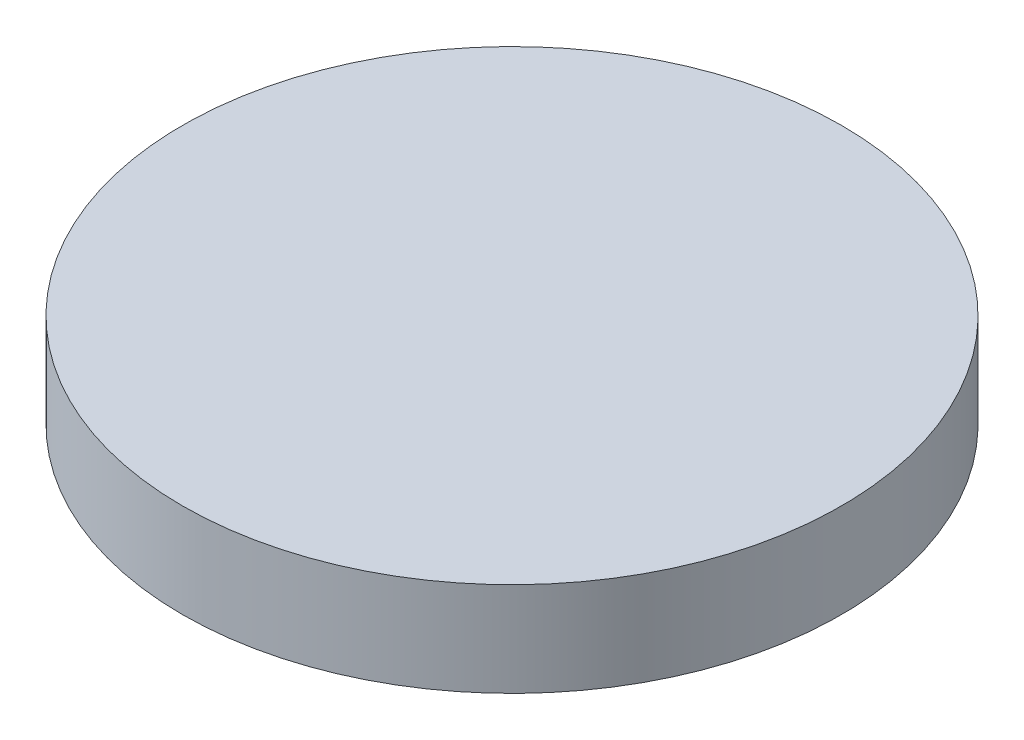
from build123d import *

# Parameters (mm, degrees)
SKETCH1_R           = 70
BOSS_EXTRUDE1_DEPTH = 20


with BuildPart() as part:
    # Sketch1 → Boss-Extrude1 (new body)
    with BuildSketch(Plane(origin=(0, 0, 0), x_dir=(1, 0, 0), z_dir=(0, 1, 0))):
        with Locations(Location((0, 0, 0), (0, 0, 270))):
            Circle(SKETCH1_R)
    extrude(amount=BOSS_EXTRUDE1_DEPTH)


solid = part.part
